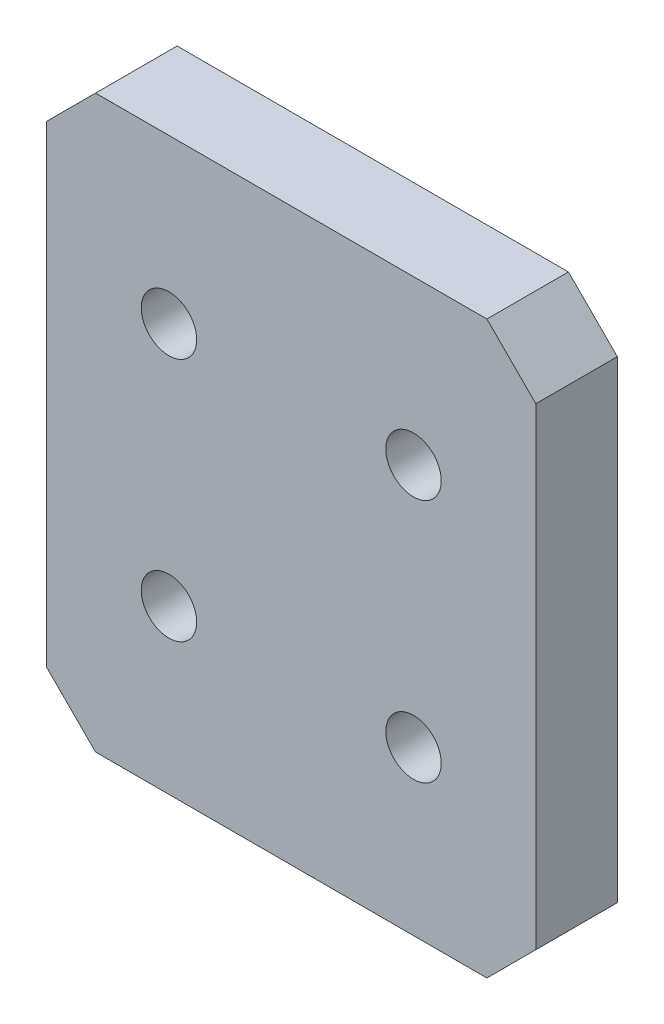
from build123d import *

# Parameters (mm, degrees)
SKETCH1_W            = 30
SKETCH1_H            = 35
BOSS_EXTRUDE1_DEPTH  = 5
M3_CLEARANCE_HOLE1_D = 3.4
CHAMFER1_SIZE        = 3


with BuildPart() as part:
    # Sketch1 → Boss-Extrude1 (new body)
    with BuildSketch(Plane.XY):
        Rectangle(SKETCH1_W, SKETCH1_H)
    extrude(amount=BOSS_EXTRUDE1_DEPTH)

    # M3 Clearance Hole1 (through all)
    with Locations(Plane.XY.offset(5)):
        with Locations((7.5, -7.5), (-7.5, 7.5), (-7.5, -7.5), (7.5, 7.5)):
            Hole(M3_CLEARANCE_HOLE1_D / 2)

    # Chamfer1
    chamfer1_edges = [part.edges().sort_by_distance(p)[0] for p in [
        (15, -17.5, 2.5),
        (-15, -17.5, 2.5),
        (-15, 17.5, 2.5),
        (15, 17.5, 2.5),
    ]]
    chamfer(chamfer1_edges, length=CHAMFER1_SIZE)


solid = part.part
